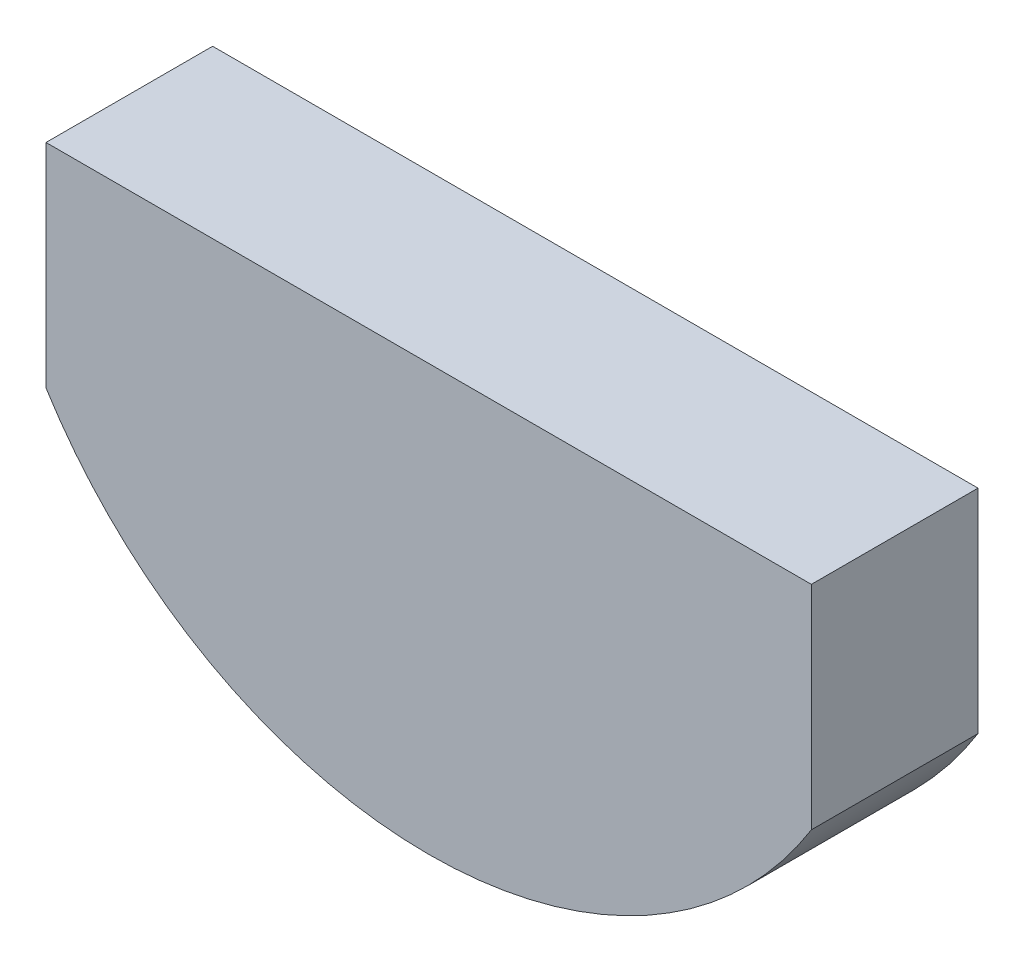
from build123d import *

# Parameters (mm, degrees)
SKETCH1_W                = 180
SKETCH1_H                = 110
BOSS_EXTRUDE1_DEPTH      = 50
BOSS_EXTRUDE2_DEPTH      = 110
CUT_EXTRUDE1_DEPTH       = 146.344418537
BOSS_EXTRUDE5_DEPTH      = 10
BOSS_EXTRUDE5_DEPTH_BACK = 10
SKETCH5_R                = 5
SKETCH6_W                = 218.788065493
SKETCH6_H                = 71.8794134
CUT_EXTRUDE2_DEPTH       = 126


with BuildPart() as part:
    # Sketch1 → Boss-Extrude1 (new body)
    with BuildSketch(Plane(origin=(0, 0, 0), x_dir=(1, 0, 0), z_dir=(0, 1, 0))):
        Rectangle(SKETCH1_W, SKETCH1_H)
    extrude(amount=BOSS_EXTRUDE1_DEPTH)

    # Sketch2 → Boss-Extrude2 (add)
    with BuildSketch(Plane(origin=(-35, 0, -55), x_dir=(1, 0, 0), z_dir=(0, 0, 1))):
        with BuildLine():
            Line((-55, 0), (125, 0))
            ThreePointArc((125, 0), (35, -50), (-55, 0))
        make_face()
    extrude(amount=BOSS_EXTRUDE2_DEPTH)

    # Sketch3 → Cut-Extrude1 (cut, through all)
    with BuildSketch(Plane(origin=(0, 50, 0), x_dir=(1, 0, 0), z_dir=(0, 1, 0))):
        Polygon((-49.118803686, -55), (-90, 15.808309091), (-90, -55), align=None)
    cut_extrude1 = extrude(amount=-CUT_EXTRUDE1_DEPTH, mode=Mode.SUBTRACT)

    # Mirror1: Cut-Extrude1 across plane
    add(cut_extrude1.mirror(Plane(origin=(0, 0, 0), x_dir=(0, 0, 1), z_dir=(1, 0, 0))), mode=Mode.SUBTRACT)

    # Sketch5 → Boss-Extrude5 (add, two sides: drawn at the far end of the back side and taken through both)
    with BuildSketch(Plane(origin=(0, 0, -55), x_dir=(-1, 0, 0), z_dir=(0, 0, -1)).offset(-BOSS_EXTRUDE5_DEPTH_BACK)):
        Circle(SKETCH5_R)
    extrude(amount=BOSS_EXTRUDE5_DEPTH + BOSS_EXTRUDE5_DEPTH_BACK)

    # Sketch4 → Revolve1 (revolve)
    with BuildSketch(Plane(origin=(-60.654801368, 0, 35.019065898), x_dir=(0.49999999999999495, 0, 0.8660254037844417), z_dir=(-0.8660254037844417, 0, 0.49999999999999495))):
        with BuildLine():
            ThreePointArc((-20.965161058, 42.942576489), (4.034838942, 17.942576489), (-20.965161058, -7.057423511))
            Line((-20.965161058, -7.057423511), (-20.965161058, 42.942576489))
        make_face()
    revolve1 = revolve(axis=Axis((-71.137381897, 42.942576489, 16.862703827), (0, -1, 0)))

    # Mirror2: Revolve1 across plane
    add(revolve1.mirror(Plane(origin=(0, 0, 0), x_dir=(0, 0, 1), z_dir=(1, 0, 0))))

    # Sketch6 → Cut-Extrude2 (cut)
    with BuildSketch(Plane(origin=(0, 50, 0), x_dir=(1, 0, 0), z_dir=(0, 1, 0))):
        with Locations((-0.333721882, -20.131397609)):
            Rectangle(SKETCH6_W, SKETCH6_H)
    extrude(amount=-CUT_EXTRUDE2_DEPTH, mode=Mode.SUBTRACT)


solid = part.part
